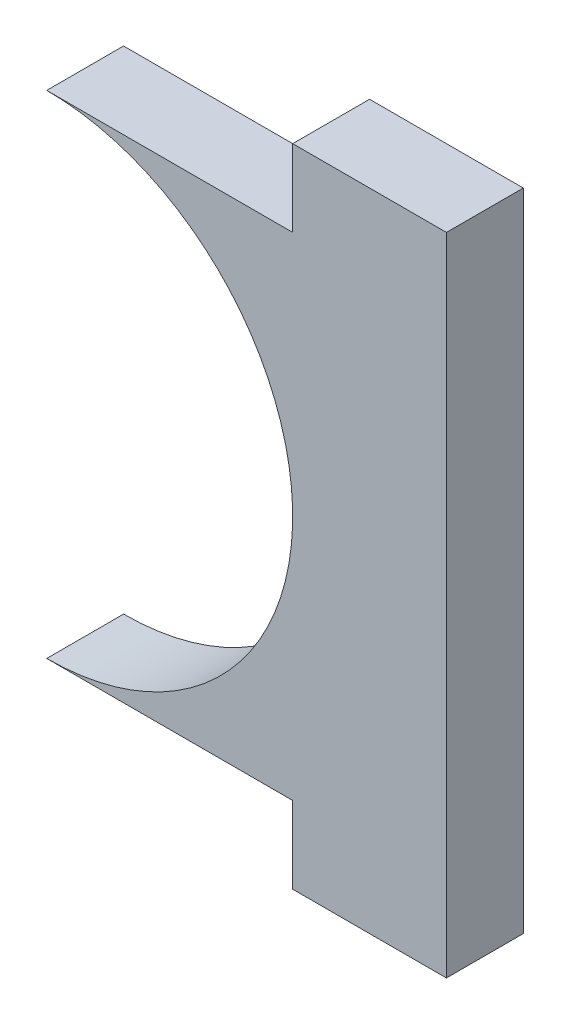
from build123d import *

# Parameters (mm, degrees)
BOSS_EXTRUDE1_DEPTH = 2.5


with BuildPart() as part:
    # Sketch1 → Boss-Extrude1 (new, symmetric)
    with BuildSketch(Plane.XY):
        with BuildLine():
            Line((0, 16), (16, 16))
            Line((16, 16), (16, 21))
            Line((16, 21), (26, 21))
            Line((26, 21), (26, 16))
            Line((26, 16), (26, -16))
            Line((26, -16), (26, -21))
            Line((26, -21), (16, -21))
            Line((16, -21), (16, -16))
            Line((16, -16), (0, -16))
            ThreePointArc((0, -16), (16, 0), (0, 16))
        make_face()
    extrude(amount=BOSS_EXTRUDE1_DEPTH, both=True)


solid = part.part
